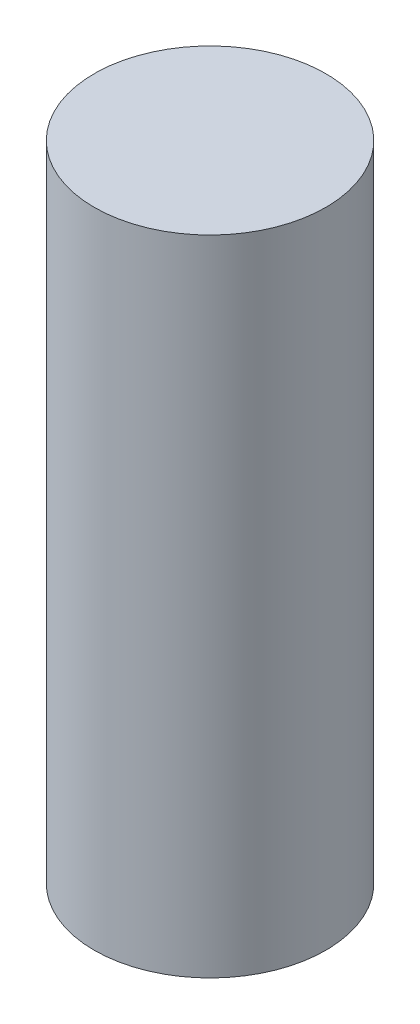
from build123d import *

# Parameters (mm, degrees)
SCHIZZO1_R                   = 4.5
ESTRUSIONE_ESTRUSIONE1_DEPTH = 25


with BuildPart() as part:
    # Schizzo1 → Estrusione-Estrusione1 (new body)
    with BuildSketch(Plane(origin=(0, 0, 0), x_dir=(1, 0, 0), z_dir=(0, 1, 0))):
        with Locations(Location((0, 0, 0), (0, 0, 270))):
            Circle(SCHIZZO1_R)
    extrude(amount=ESTRUSIONE_ESTRUSIONE1_DEPTH)


solid = part.part
